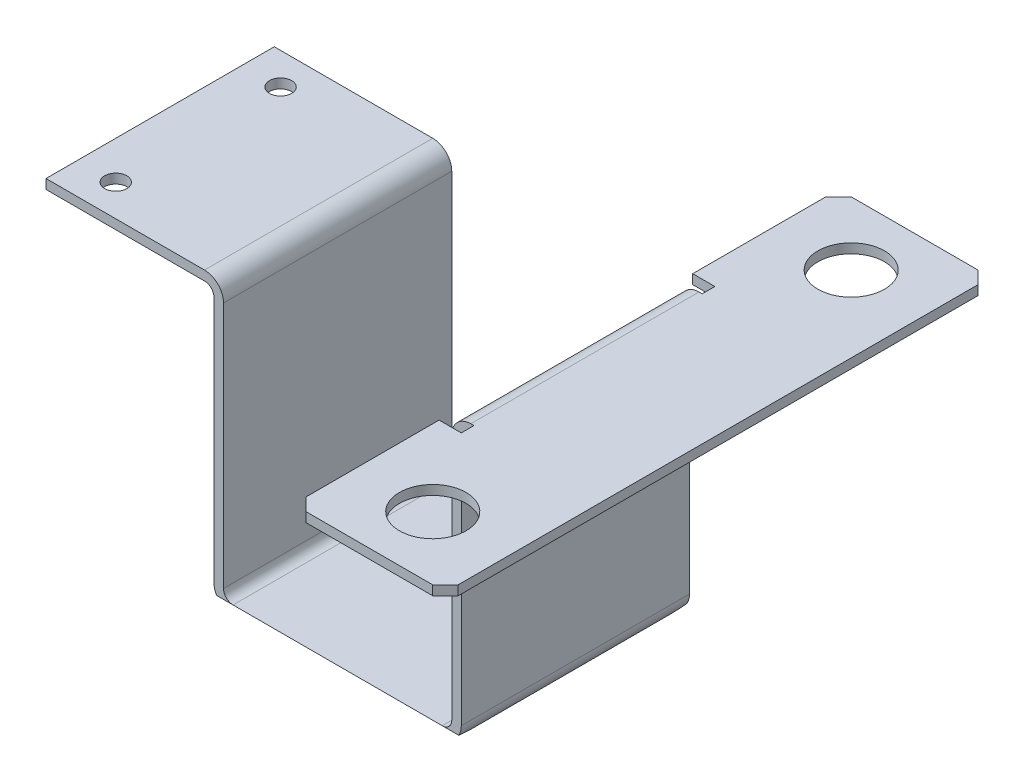
from build123d import *

# Parameters (mm, degrees)
EXTRUDE_1_DEPTH     = 36
SKETCH_2_R          = 1.75
CUT_EXTRUDE_1_DEPTH = 35
FILLET_1_R          = 1.5
FILLET_2_R          = 3
CUT_EXTRUDE_5_DEPTH = 50
SKETCH_5_W          = 24
SKETCH_5_H          = 86
SKETCH_5_R          = 5.25
EXTRUDE_2_DEPTH     = 1.5
SKETCH_6_W          = 2
SKETCH_6_H          = 6.336440046
CUT_EXTRUDE_6_DEPTH = 3.5
FILLET_3_R          = 1.5
FILLET_4_R          = 3
CHAMFER_1_SIZE      = 2
SKETCH_7_W          = 36
SKETCH_7_H          = 1.5
CUT_EXTRUDE_7_DEPTH = 4


with BuildPart() as part:
    # Эскиз1 → Вытянуть1 (new body)
    with BuildSketch(Plane.XY):
        Polygon((-32, 43.5), (0, 43.5), (0, 0), (36, 0), (36, 43.5), (60, 43.5), (60, 42), (37.5, 42), (37.5, -1.5), (-1.5, -1.5), (-1.5, 42), (-32, 42), align=None)
    extrude(amount=EXTRUDE_1_DEPTH)

    # Эскиз2 → Вырез-Вытянуть1 (cut)
    with BuildSketch(Plane(origin=(0, 43.5, 0), x_dir=(-1, 0, 0), z_dir=(0, 1, 0))):
        with Locations(Location((22, 5, 0), (0, 0, 90))):
            Circle(SKETCH_2_R)
        with Locations(Location((22, 31, 0), (0, 0, 90))):
            Circle(SKETCH_2_R)
    extrude(amount=-CUT_EXTRUDE_1_DEPTH, mode=Mode.SUBTRACT)

    # Скругление1
    fillet_1_edges = [part.edges().sort_by_distance(p)[0] for p in [
        (0, 0, 18),
        (36, 0, 18),
        (-1.5, 42, 18),
    ]]
    fillet(fillet_1_edges, radius=FILLET_1_R)

    # Скругление2
    fillet_2_edges = [part.edges().sort_by_distance(p)[0] for p in [
        (0, 43.5, 18),
        (37.5, -1.5, 18),
        (-1.5, -1.5, 18),
    ]]
    fillet(fillet_2_edges, radius=FILLET_2_R)

    # Эскиз4 → Вырез-Вытянуть5 (cut)
    with BuildSketch(Plane.ZY.offset(1.5)):
        Polygon((36, 0), (30.401923789, -1.5), (5.598076211, -1.5), (0, 0), (0, -9.726752533), (36, -8.93099636), align=None)
    extrude(amount=-CUT_EXTRUDE_5_DEPTH, mode=Mode.SUBTRACT)

    # Эскиз5 → Вытянуть2 (add)
    with BuildSketch(Plane(origin=(0, 43.5, 0), x_dir=(-1, 0, 0), z_dir=(0, 1, 0))):
        with Locations((-48, 18)):
            Rectangle(SKETCH_5_W, SKETCH_5_H)
        with Locations(Location((-48, -15, 0), (0, 0, 90))):
            Circle(SKETCH_5_R, mode=Mode.SUBTRACT)
        with Locations(Location((-48, 51, 0), (0, 0, 270))):
            Circle(SKETCH_5_R, mode=Mode.SUBTRACT)
    extrude(amount=-EXTRUDE_2_DEPTH)

    # Эскиз6 → Вырез-Вытянуть6 (cut)
    with BuildSketch(Plane.ZY.offset(-36)):
        with Locations((37, 42.938728947)):
            Rectangle(SKETCH_6_W, SKETCH_6_H)
        with Locations((-1, 42.938728947)):
            Rectangle(SKETCH_6_W, SKETCH_6_H)
    extrude(amount=-CUT_EXTRUDE_6_DEPTH, mode=Mode.SUBTRACT)

    # Скругление3
    fillet_3_edges = [part.edges().sort_by_distance(p)[0] for p in [
        (37.5, 42, 18),
    ]]
    fillet(fillet_3_edges, radius=FILLET_3_R)

    # Скругление4
    fillet_4_edges = [part.edges().sort_by_distance(p)[0] for p in [
        (36, 43.5, 18),
    ]]
    fillet(fillet_4_edges, radius=FILLET_4_R)

    # Фаска1
    chamfer_1_edges = [part.edges().sort_by_distance(p)[0] for p in [
        (36, 42.75, 61),
        (36, 42.75, -25),
        (60, 42.75, -25),
        (60, 42.75, 61),
    ]]
    chamfer(chamfer_1_edges, length=CHAMFER_1_SIZE)

    # Эскиз7 → Вырез-Вытянуть7 (cut)
    with BuildSketch(Plane.ZY.offset(32)):
        with Locations((18, 42.75)):
            Rectangle(SKETCH_7_W, SKETCH_7_H)
    extrude(amount=-CUT_EXTRUDE_7_DEPTH, mode=Mode.SUBTRACT)


solid = part.part
